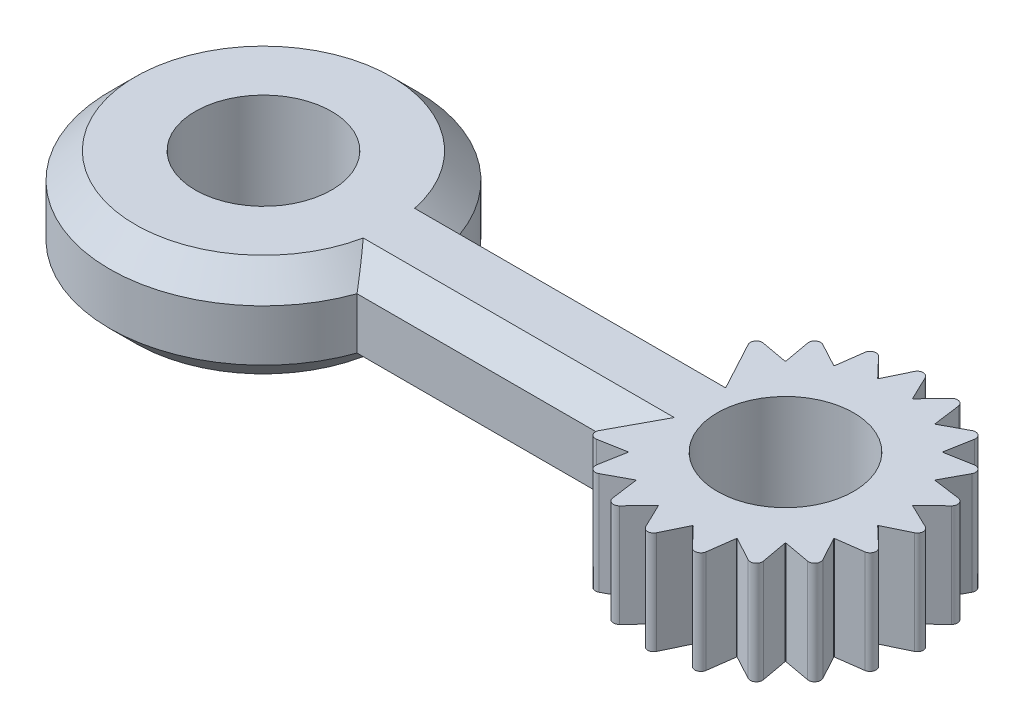
from build123d import *

# Parameters (mm, degrees)
SKETCH1_R           = 3.98
BOSS_EXTRUDE1_DEPTH = 6
FILLET1_R           = 0.35
CHAMFER1_SIZE       = 1.5


with BuildPart() as part:
    # Sketch1 → Boss-Extrude1 (new body)
    with BuildSketch(Plane(origin=(0, 0, 0), x_dir=(1, 0, 0), z_dir=(0, 1, 0))):
        with BuildLine():
            Line((-14.732151132, 3), (-22.015934783, 3))
            ThreePointArc((-22.015934783, 3), (-39.46, 0), (-22.015934783, -3))
            Line((-22.015934783, -3), (-5.802039289, -3))
            Line((-5.802039289, -3), (-6.876644452, -4.996174644))
            Line((-6.876644452, -4.996174644), (-4.608220474, -4.58413613))
            ThreePointArc((-4.608220474, -4.58413613), (-4.596194078, -4.596194078), (-4.58413613, -4.608220474))
            Line((-4.58413613, -4.608220474), (-4.996174644, -6.876644452))
            Line((-4.996174644, -6.876644452), (-2.966102142, -5.783790979))
            ThreePointArc((-2.966102142, -5.783790979), (-2.950938248, -5.791542407), (-2.935754098, -5.799254079))
            Line((-2.935754098, -5.799254079), (-2.626644452, -8.083980389))
            Line((-2.626644452, -8.083980389), (-1.033641065, -6.417288068))
            ThreePointArc((-1.033641065, -6.417288068), (-1.016824023, -6.419974214), (-1, -6.422616289))
            Line((-1, -6.422616289), (0, -8.5))
            Line((0, -8.5), (1, -6.422616289))
            ThreePointArc((1, -6.422616289), (1.016824023, -6.419974214), (1.033641065, -6.417288068))
            Line((1.033641065, -6.417288068), (2.626644452, -8.083980389))
            Line((2.626644452, -8.083980389), (2.935754098, -5.799254079))
            ThreePointArc((2.935754098, -5.799254079), (2.950938248, -5.791542407), (2.966102142, -5.783790979))
            Line((2.966102142, -5.783790979), (4.996174644, -6.876644452))
            Line((4.996174644, -6.876644452), (4.58413613, -4.608220474))
            ThreePointArc((4.58413613, -4.608220474), (4.596194078, -4.596194078), (4.608220474, -4.58413613))
            Line((4.608220474, -4.58413613), (6.876644452, -4.996174644))
            Line((6.876644452, -4.996174644), (5.783790979, -2.966102142))
            ThreePointArc((5.783790979, -2.966102142), (5.791542407, -2.950938248), (5.799254079, -2.935754098))
            Line((5.799254079, -2.935754098), (8.083980389, -2.626644452))
            Line((8.083980389, -2.626644452), (6.417288068, -1.033641065))
            ThreePointArc((6.417288068, -1.033641065), (6.419974214, -1.016824023), (6.422616289, -1))
            Line((6.422616289, -1), (8.5, 0))
            Line((8.5, 0), (6.422616289, 1))
            ThreePointArc((6.422616289, 1), (6.419974214, 1.016824023), (6.417288068, 1.033641065))
            Line((6.417288068, 1.033641065), (8.083980389, 2.626644452))
            Line((8.083980389, 2.626644452), (5.799254079, 2.935754098))
            ThreePointArc((5.799254079, 2.935754098), (5.791542407, 2.950938248), (5.783790979, 2.966102142))
            Line((5.783790979, 2.966102142), (6.876644452, 4.996174644))
            Line((6.876644452, 4.996174644), (4.608220474, 4.58413613))
            ThreePointArc((4.608220474, 4.58413613), (4.596194078, 4.596194078), (4.58413613, 4.608220474))
            Line((4.58413613, 4.608220474), (4.996174644, 6.876644452))
            Line((4.996174644, 6.876644452), (2.966102142, 5.783790979))
            ThreePointArc((2.966102142, 5.783790979), (2.950938248, 5.791542407), (2.935754098, 5.799254079))
            Line((2.935754098, 5.799254079), (2.626644452, 8.083980389))
            Line((2.626644452, 8.083980389), (1.033641065, 6.417288068))
            ThreePointArc((1.033641065, 6.417288068), (1.016824023, 6.419974214), (1, 6.422616289))
            Line((1, 6.422616289), (0, 8.5))
            Line((0, 8.5), (-1, 6.422616289))
            ThreePointArc((-1, 6.422616289), (-1.016824023, 6.419974214), (-1.033641065, 6.417288068))
            Line((-1.033641065, 6.417288068), (-2.626644452, 8.083980389))
            Line((-2.626644452, 8.083980389), (-2.935754098, 5.799254079))
            ThreePointArc((-2.935754098, 5.799254079), (-2.950938248, 5.791542407), (-2.966102142, 5.783790979))
            Line((-2.966102142, 5.783790979), (-4.996174644, 6.876644452))
            Line((-4.996174644, 6.876644452), (-4.58413613, 4.608220474))
            ThreePointArc((-4.58413613, 4.608220474), (-4.596194078, 4.596194078), (-4.608220474, 4.58413613))
            Line((-4.608220474, 4.58413613), (-6.876644452, 4.996174644))
            Line((-6.876644452, 4.996174644), (-5.802039289, 3))
            Line((-5.802039289, 3), (-14.732151132, 3))
        make_face()
        with Locations(Location((-30.48, 0, 0), (0, 0, 270))):
            Circle(SKETCH1_R, mode=Mode.SUBTRACT)
        with Locations(Location((0, 0, 0), (0, 0, 270))):
            Circle(SKETCH1_R, mode=Mode.SUBTRACT)
    extrude(amount=BOSS_EXTRUDE1_DEPTH)

    # Fillet1
    fillet1_edges = [part.edges().sort_by_distance(p)[0] for p in [
        (0, 3, 8.5),
        (-2.626644452, 3, 8.083980389),
        (-4.996174644, 3, 6.876644452),
        (-6.876644452, 3, 4.996174644),
        (-6.876644452, 3, -4.996174644),
        (-4.996174644, 3, -6.876644452),
        (-2.626644452, 3, -8.083980389),
        (0, 3, -8.5),
        (2.626644452, 3, -8.083980389),
        (4.996174644, 3, -6.876644452),
        (6.876644452, 3, -4.996174644),
        (8.083980389, 3, -2.626644452),
        (8.5, 3, 0),
        (8.083980389, 3, 2.626644452),
        (6.876644452, 3, 4.996174644),
        (4.996174644, 3, 6.876644452),
        (2.626644452, 3, 8.083980389),
    ]]
    fillet(fillet1_edges, radius=FILLET1_R)

    # Chamfer1
    chamfer1_edges = [part.edges().sort_by_distance(p)[0] for p in [
        (-13.908987036, 6, -3),
        (-39.46, 6, 0),
        (-13.908987036, 6, 3),
        (-13.908987036, 0, 3),
        (-39.46, 0, 0),
        (-13.908987036, 0, -3),
    ]]
    chamfer(chamfer1_edges, length=CHAMFER1_SIZE)


solid = part.part
